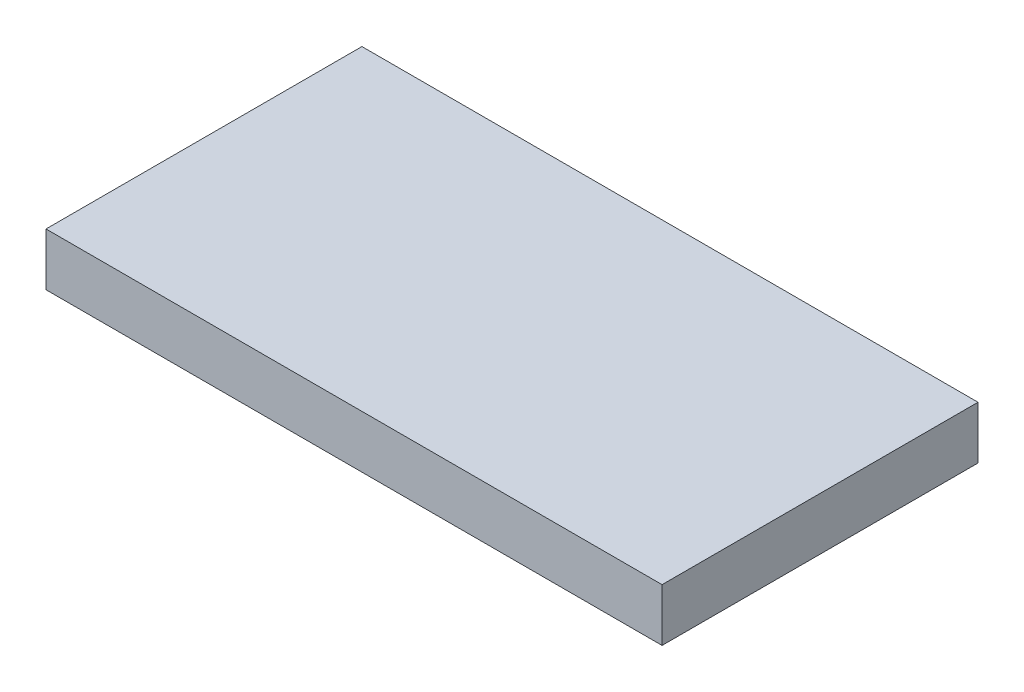
from build123d import *

# Parameters (mm, degrees)
SKETCH_1_W      = 23.4
SKETCH_1_H      = 12
EXTRUDE_1_DEPTH = 2


with BuildPart() as part:
    # 草图1 → 凸台-拉伸1 (new body)
    with BuildSketch(Plane(origin=(0, 0, 0), x_dir=(1, 0, 0), z_dir=(0, 1, 0))):
        with Locations((11.7, -6)):
            Rectangle(SKETCH_1_W, SKETCH_1_H)
    extrude(amount=EXTRUDE_1_DEPTH)


solid = part.part
